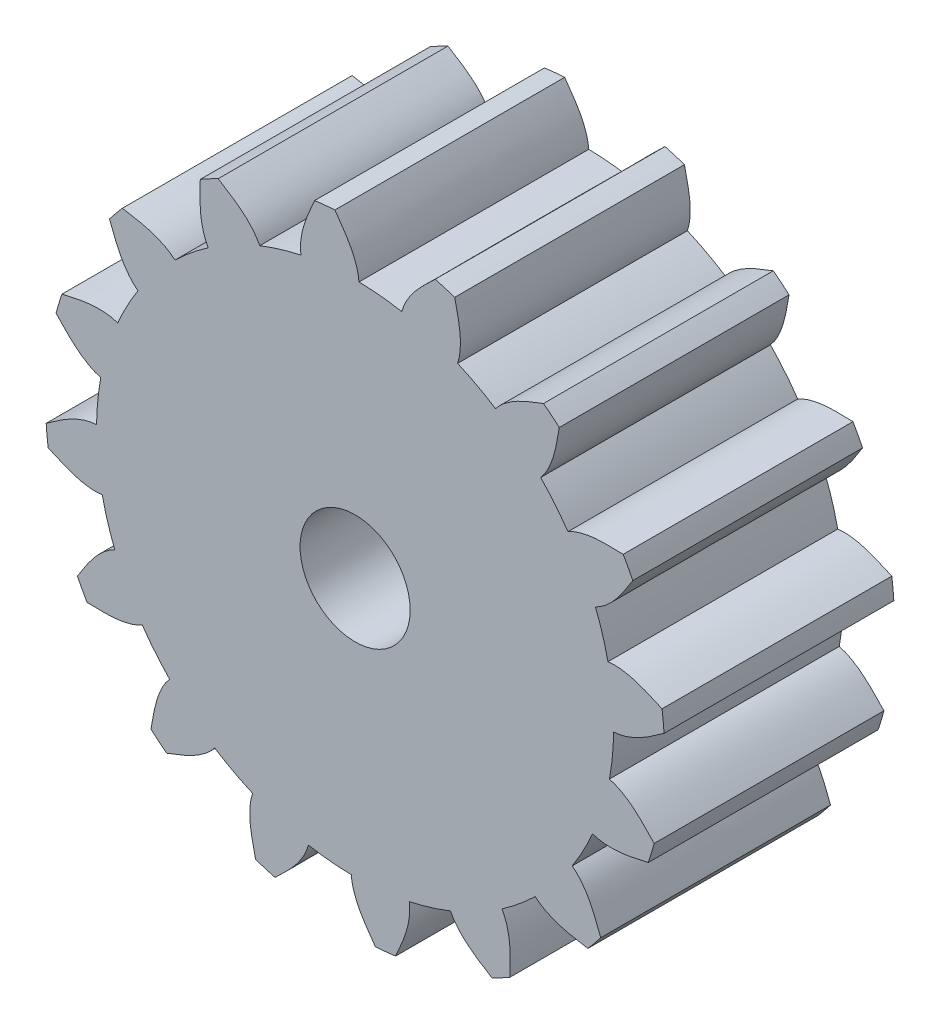
from build123d import *

# Parameters (mm, degrees)
BOSS_EXTRUDE7_DEPTH = 1.67
CIRPATTERN1_COUNT   = 16
DIAMETRO_BASE_R     = 1.879385242
BOSS_EXTRUDE9_DEPTH = 1.67
MOZZO_R             = 0.4
CUT_EXTRUDE1_DEPTH  = 1.67


with BuildPart() as part:
    # profilo → Boss-Extrude7 (new body)
    with BuildSketch(Plane.XY):
        with BuildLine():
            Line((-0.220538566, 2.239165635), (-0.184211967, 1.870335488))
            ThreePointArc((-0.184211967, 1.870335488), (-0.078225963, 1.87775653), (0.028010042, 1.879176501))
            add(Edge.make_bspline(
                [(-0.14670524, 2.245212144), (-0.068888242, 2.136288179), (0.01902302, 2.014536344), (0.028010042, 1.879176501)],
                knots=[0.201514188, 0.201514188, 0.201514188, 0.201514188, 1, 1, 1, 1], degree=3))
            ThreePointArc((-0.14670524, 2.245212144), (-0.18364679, 2.242492777), (-0.220538566, 2.239165635))
        make_face()
    extrude(amount=BOSS_EXTRUDE7_DEPTH)

    # Mirror1: part across plane


with BuildPart() as part_1:
    add(part.part)
    add(part.part.mirror(Plane(origin=(0, 0, 0), x_dir=(0, 0, 1), z_dir=(0.9951847266721969, 0.09801714032956144, 0))))


with BuildPart() as cirpattern1_1:
    # CirPattern1: pattern copy
    add(part_1.part.rotate(Axis((0, 0, 1.67), (0, 0, 1)), 1 * 360 / CIRPATTERN1_COUNT))


with BuildPart() as cirpattern1_2:
    # CirPattern1: pattern copy
    add(part_1.part.rotate(Axis((0, 0, 1.67), (0, 0, 1)), 2 * 360 / CIRPATTERN1_COUNT))


with BuildPart() as cirpattern1_3:
    # CirPattern1: pattern copy
    add(part_1.part.rotate(Axis((0, 0, 1.67), (0, 0, 1)), 3 * 360 / CIRPATTERN1_COUNT))


with BuildPart() as cirpattern1_4:
    # CirPattern1: pattern copy
    add(part_1.part.rotate(Axis((0, 0, 1.67), (0, 0, 1)), 4 * 360 / CIRPATTERN1_COUNT))


with BuildPart() as cirpattern1_5:
    # CirPattern1: pattern copy
    add(part_1.part.rotate(Axis((0, 0, 1.67), (0, 0, 1)), 5 * 360 / CIRPATTERN1_COUNT))


with BuildPart() as cirpattern1_6:
    # CirPattern1: pattern copy
    add(part_1.part.rotate(Axis((0, 0, 1.67), (0, 0, 1)), 6 * 360 / CIRPATTERN1_COUNT))


with BuildPart() as cirpattern1_7:
    # CirPattern1: pattern copy
    add(part_1.part.rotate(Axis((0, 0, 1.67), (0, 0, 1)), 7 * 360 / CIRPATTERN1_COUNT))


with BuildPart() as cirpattern1_8:
    # CirPattern1: pattern copy
    add(part_1.part.rotate(Axis((0, 0, 1.67), (0, 0, 1)), 8 * 360 / CIRPATTERN1_COUNT))


with BuildPart() as cirpattern1_9:
    # CirPattern1: pattern copy
    add(part_1.part.rotate(Axis((0, 0, 1.67), (0, 0, 1)), 9 * 360 / CIRPATTERN1_COUNT))


with BuildPart() as cirpattern1_10:
    # CirPattern1: pattern copy
    add(part_1.part.rotate(Axis((0, 0, 1.67), (0, 0, 1)), 10 * 360 / CIRPATTERN1_COUNT))


with BuildPart() as cirpattern1_11:
    # CirPattern1: pattern copy
    add(part_1.part.rotate(Axis((0, 0, 1.67), (0, 0, 1)), 11 * 360 / CIRPATTERN1_COUNT))


with BuildPart() as cirpattern1_12:
    # CirPattern1: pattern copy
    add(part_1.part.rotate(Axis((0, 0, 1.67), (0, 0, 1)), 12 * 360 / CIRPATTERN1_COUNT))


with BuildPart() as cirpattern1_13:
    # CirPattern1: pattern copy
    add(part_1.part.rotate(Axis((0, 0, 1.67), (0, 0, 1)), 13 * 360 / CIRPATTERN1_COUNT))


with BuildPart() as cirpattern1_14:
    # CirPattern1: pattern copy
    add(part_1.part.rotate(Axis((0, 0, 1.67), (0, 0, 1)), 14 * 360 / CIRPATTERN1_COUNT))


with BuildPart() as cirpattern1_15:
    # CirPattern1: pattern copy
    add(part_1.part.rotate(Axis((0, 0, 1.67), (0, 0, 1)), 15 * 360 / CIRPATTERN1_COUNT))


with BuildPart() as part_2:
    add(part_1.part)

    add(cirpattern1_1.part)  # Boss-Extrude9 merges CirPattern1_1

    add(cirpattern1_2.part)  # Boss-Extrude9 merges CirPattern1_2

    add(cirpattern1_3.part)  # Boss-Extrude9 merges CirPattern1_3

    add(cirpattern1_4.part)  # Boss-Extrude9 merges CirPattern1_4

    add(cirpattern1_5.part)  # Boss-Extrude9 merges CirPattern1_5

    add(cirpattern1_6.part)  # Boss-Extrude9 merges CirPattern1_6

    add(cirpattern1_7.part)  # Boss-Extrude9 merges CirPattern1_7

    add(cirpattern1_8.part)  # Boss-Extrude9 merges CirPattern1_8

    add(cirpattern1_9.part)  # Boss-Extrude9 merges CirPattern1_9

    add(cirpattern1_10.part)  # Boss-Extrude9 merges CirPattern1_10

    add(cirpattern1_11.part)  # Boss-Extrude9 merges CirPattern1_11

    add(cirpattern1_12.part)  # Boss-Extrude9 merges CirPattern1_12

    add(cirpattern1_13.part)  # Boss-Extrude9 merges CirPattern1_13

    add(cirpattern1_14.part)  # Boss-Extrude9 merges CirPattern1_14

    add(cirpattern1_15.part)  # Boss-Extrude9 merges CirPattern1_15
    # diametro base → Boss-Extrude9 (add)
    with BuildSketch(Plane.XY):
        Circle(DIAMETRO_BASE_R)
    extrude(amount=BOSS_EXTRUDE9_DEPTH)

    # mozzo → Cut-Extrude1 (cut)
    with BuildSketch(Plane.XY):
        Circle(MOZZO_R)
    extrude(amount=CUT_EXTRUDE1_DEPTH, mode=Mode.SUBTRACT)


solid = part_2.part
